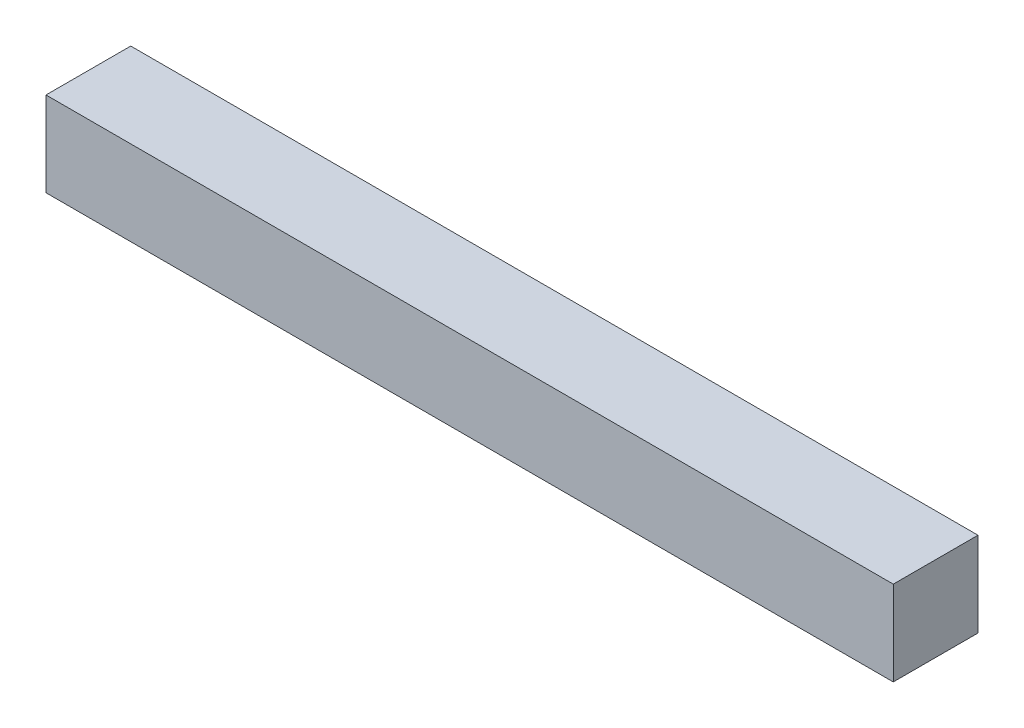
from build123d import *

# Parameters (mm, degrees)
SKETCH1_W      = 10
SKETCH1_H      = 1
EXTRUDE4_DEPTH = 1


with BuildPart() as part:
    # Sketch1 → Extrude4 (new body)
    with BuildSketch(Plane.XY):
        with Locations((5, 0.5)):
            Rectangle(SKETCH1_W, SKETCH1_H)
    extrude(amount=EXTRUDE4_DEPTH)


solid = part.part
